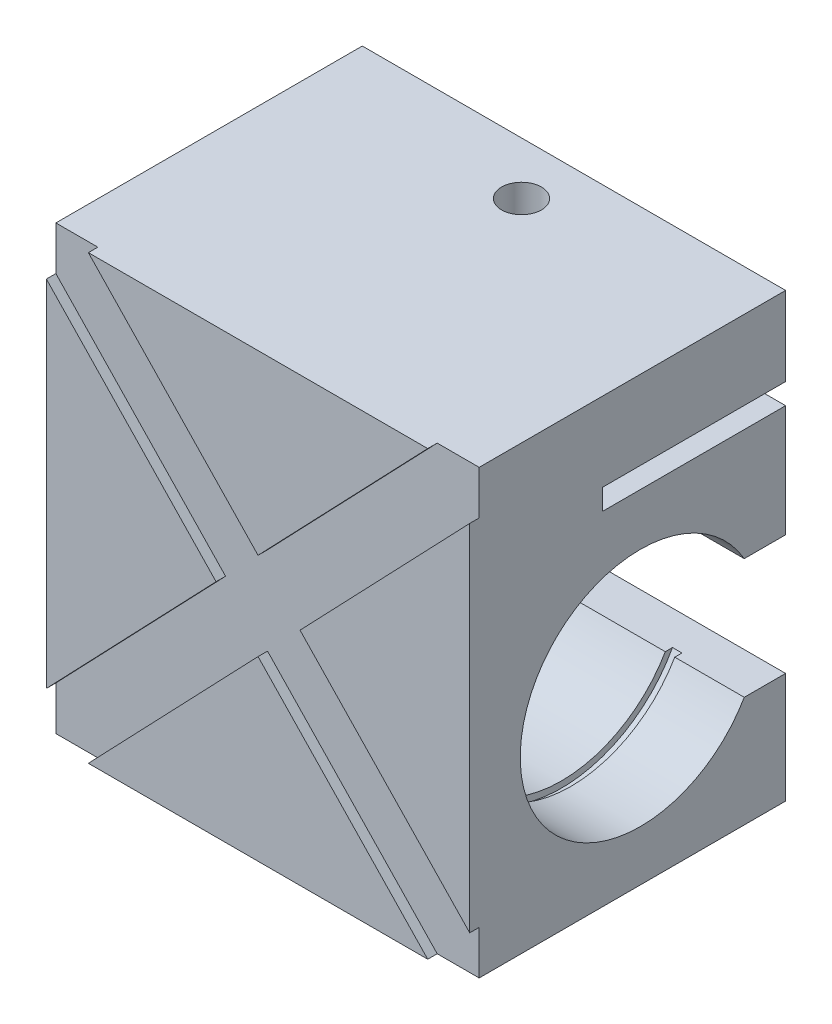
from build123d import *

# Parameters (mm, degrees)
SKETCH1_W           = 67
SKETCH1_H           = 50
BOSS_EXTRUDE1_DEPTH = 70
SKETCH2_R           = 19
SKETCH2_W           = 10.070179366
SKETCH2_H           = 19
CUT_EXTRUDE1_DEPTH  = 70
CUT_EXTRUDE2_DEPTH  = 70
SKETCH4_R           = 20
CUT_EXTRUDE3_DEPTH  = 1.5
CUT_EXTRUDE4_START  = -1.5
SKETCH5_R           = 20
CUT_EXTRUDE4_DEPTH  = 1.5
CUT_EXTRUDE5_DEPTH  = 1.5
CUT_EXTRUDE6_REACH  = 111.037
SKETCH7_R           = 3.15


with BuildPart() as part:
    # Sketch1 → Boss-Extrude1 (new body)
    with BuildSketch(Plane(origin=(0, 0, 0), x_dir=(1, 0, 0), z_dir=(0, 1, 0))):
        with Locations((33.5, 25)):
            Rectangle(SKETCH1_W, SKETCH1_H)
    extrude(amount=BOSS_EXTRUDE1_DEPTH)

    # Sketch2 → Cut-Extrude1 (cut)
    with BuildSketch(Plane(origin=(67, 0, 0), x_dir=(0, 0, -1), z_dir=(1, 0, 0))):
        with Locations((27, 27)):
            Circle(SKETCH2_R)
        with BuildLine():
            Line((50, 36.5), (43.454482672, 36.5))
            ThreePointArc((43.454482672, 36.5), (45.352590699, 31.917561857), (46, 27))
            ThreePointArc((46, 27), (45.352590699, 22.082438143), (43.454482672, 17.5))
            Line((43.454482672, 17.5), (50, 17.5))
            Line((50, 17.5), (50, 36.5))
        make_face()
        with Locations((55.035089683, 27)):
            Rectangle(SKETCH2_W, SKETCH2_H)
    extrude(amount=-CUT_EXTRUDE1_DEPTH, mode=Mode.SUBTRACT)

    # Sketch3 → Cut-Extrude2 (cut)
    with BuildSketch(Plane(origin=(67, 0, 0), x_dir=(0, 0, -1), z_dir=(1, 0, 0))):
        Polygon((50, 57.5), (21, 57.5), (21, 54.2), (50, 54.2), (56.198603949, 54.2), (56.198603949, 57.5), align=None)
    extrude(amount=-CUT_EXTRUDE2_DEPTH, mode=Mode.SUBTRACT)

    # Sketch4 → Cut-Extrude3 (cut)
    with BuildSketch(Plane(origin=(54.5, 0, 0), x_dir=(0, 0, -1), z_dir=(1, 0, 0))):
        with Locations((27, 27)):
            Circle(SKETCH4_R)
    extrude(amount=CUT_EXTRUDE3_DEPTH, mode=Mode.SUBTRACT)

    # Sketch5 → Cut-Extrude4 (cut)
    with BuildSketch(Plane(origin=(12.5, 0, 0), x_dir=(0, 0, -1), z_dir=(1, 0, 0)).offset(CUT_EXTRUDE4_START)):
        with Locations((27, 27)):
            Circle(SKETCH5_R)
    extrude(amount=CUT_EXTRUDE4_DEPTH, mode=Mode.SUBTRACT)

    # Sketch6 → Cut-Extrude5 (cut)
    with BuildSketch(Plane.XY):
        Polygon((0, 70), (0, 63.058135949), (26.855644409, 35), (0, 6.941864051), (0, 0), (6.644355591, 0), (33.5, 28.058135949), (60.355644409, 0), (67, 0), (67, 6.941864051), (40.144355591, 35), (67, 63.058135949), (67, 70), (60.355644409, 70), (33.5, 41.941864051), (6.644355591, 70), align=None)
    extrude(amount=-CUT_EXTRUDE5_DEPTH, mode=Mode.SUBTRACT)

    # Sketch7 → Cut-Extrude6 (cut, up to next)
    with BuildSketch(Plane(origin=(0, 70, 0), x_dir=(1, 0, 0), z_dir=(0, 1, 0)), mode=Mode.PRIVATE) as cut_extrude6_sk1:
        with Locations(Location((33.5, 41.7, 0), (0, 0, 270))):
            Circle(SKETCH7_R)
    cut_extrude6_tool1 = extrude(cut_extrude6_sk1.sketch, amount=-CUT_EXTRUDE6_REACH, mode=Mode.PRIVATE) & part.part
    add(cut_extrude6_tool1.solids().sort_by_distance((33.5, 70, -41.7))[0], mode=Mode.SUBTRACT)


solid = part.part
